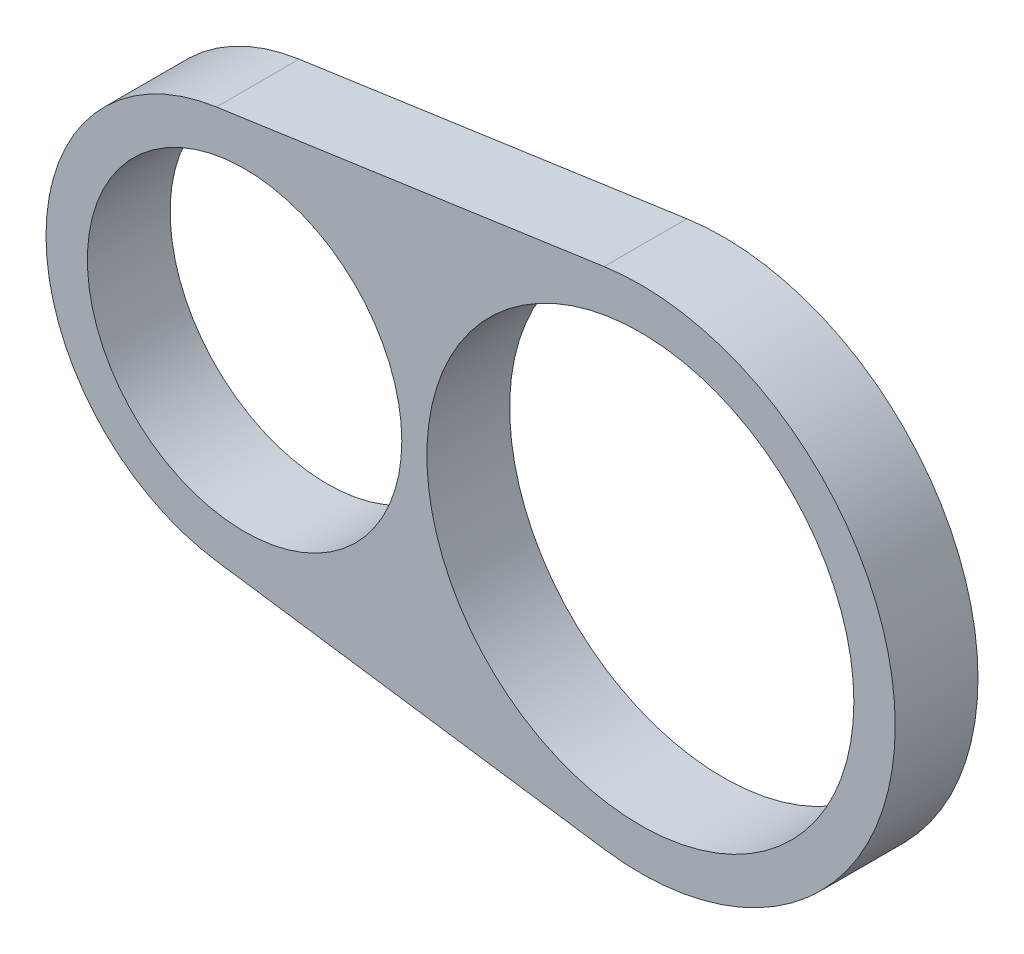
from build123d import *

# Parameters (mm, degrees)
ESBO_O1_R                = 25.8
ESBO_O1_R_2              = 19
RESSALTO_EXTRUS_O1_DEPTH = 10


with BuildPart() as part:
    # Esboço1 → Ressalto-extrusão1 (new body)
    with BuildSketch(Plane.XY):
        with BuildLine():
            Line((19.536158269, 30.487140651), (-27.327084466, 23.756213495))
            ThreePointArc((-27.327084466, 23.756213495), (-47.915, 0), (-27.327084466, -23.756213495))
            Line((-27.327084466, -23.756213495), (19.536158269, -30.487140651))
            ThreePointArc((19.536158269, -30.487140651), (54.715, 0), (19.536158269, 30.487140651))
        make_face()
        with Locations((23.915, 0)):
            Circle(ESBO_O1_R, mode=Mode.SUBTRACT)
        with Locations((-23.915, 0)):
            Circle(ESBO_O1_R_2, mode=Mode.SUBTRACT)
    extrude(amount=RESSALTO_EXTRUS_O1_DEPTH)


solid = part.part
